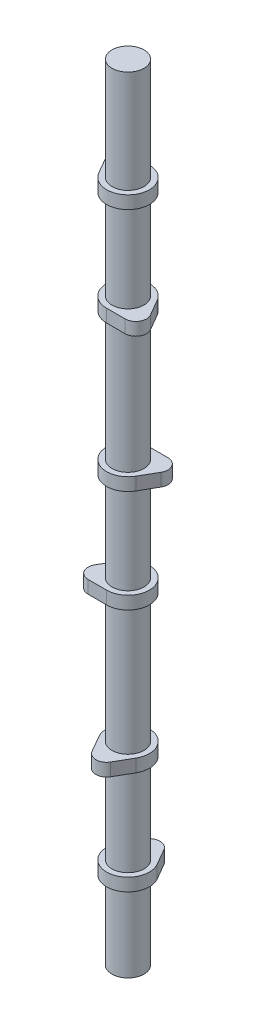
from build123d import *

# Parameters (mm, degrees)
BOSS_EXTRUDE1_DEPTH   = 7.62
LPATTERN1_COUNT       = 2
LPATTERN1_PITCH       = 60.96
BODY_MOVE_COPY1_ANGLE = 180
LPATTERN2_COUNT       = 3
LPATTERN2_PITCH       = 145.05
BODY_MOVE_COPY2_ANGLE = 120
BODY_MOVE_COPY3_ANGLE = 120
BOSS_EXTRUDE2_START   = -46.53
SKETCH2_R             = 9.5
BOSS_EXTRUDE2_DEPTH   = 466.09


with BuildPart() as part:
    # Sketch1 → Boss-Extrude1 (new body)
    with BuildSketch(Plane(origin=(0, 0, 0), x_dir=(1, 0, 0), z_dir=(0, 1, 0))):
        with BuildLine():
            Line((-5.499261314, 15.875), (-10.998522628, 6.35))
            ThreePointArc((-10.998522628, 6.35), (0, -12.7), (10.998522628, 6.35))
            Line((10.998522628, 6.35), (5.499261314, 15.875))
            ThreePointArc((5.499261314, 15.875), (0, 19.05), (-5.499261314, 15.875))
        make_face()
    extrude(amount=BOSS_EXTRUDE1_DEPTH)


with BuildPart() as lpattern1_1:
    # LPattern1: pattern copy
    add(part.part.moved(Location(Vector(0, 1, 0) * (1 * LPATTERN1_PITCH))))


with BuildPart() as lpattern1_1_1:
    # Body-Move/Copy1: moved
    add(lpattern1_1.part.rotate(Axis((0, 0, 0), (0, 1, 0)), BODY_MOVE_COPY1_ANGLE))


with BuildPart() as lpattern2_1:
    # LPattern2: pattern copy
    add(part.part.moved(Location(Vector(0, 1, 0) * (1 * LPATTERN2_PITCH))))


with BuildPart() as lpattern2_2:
    # LPattern2: pattern copy
    add(part.part.moved(Location(Vector(0, 1, 0) * (2 * LPATTERN2_PITCH))))


with BuildPart() as lpattern2_3:
    # LPattern2: pattern copy
    add(lpattern1_1_1.part.moved(Location(Vector(0, 1, 0) * (1 * LPATTERN2_PITCH))))


with BuildPart() as lpattern2_4:
    # LPattern2: pattern copy
    add(lpattern1_1_1.part.moved(Location(Vector(0, 1, 0) * (2 * LPATTERN2_PITCH))))


with BuildPart() as lpattern2_1_1:
    # Body-Move/Copy2: moved
    add(lpattern2_1.part.rotate(Axis((0, 0, 0), (0, 1, 0)), BODY_MOVE_COPY2_ANGLE))


with BuildPart() as lpattern2_3_1:
    # Body-Move/Copy2: moved
    add(lpattern2_3.part.rotate(Axis((0, 0, 0), (0, 1, 0)), BODY_MOVE_COPY2_ANGLE))


with BuildPart() as lpattern2_2_1:
    # Body-Move/Copy3: moved
    add(lpattern2_2.part.rotate(Axis((0, 0, 0), (0, -1, 0)), BODY_MOVE_COPY3_ANGLE))


with BuildPart() as lpattern2_4_1:
    # Body-Move/Copy3: moved
    add(lpattern2_4.part.rotate(Axis((0, 0, 0), (0, -1, 0)), BODY_MOVE_COPY3_ANGLE))


with BuildPart() as part_1:
    add(part.part)

    add(lpattern1_1_1.part)  # Boss-Extrude2 merges LPattern1_1

    add(lpattern2_1_1.part)  # Boss-Extrude2 merges LPattern2_1

    add(lpattern2_2_1.part)  # Boss-Extrude2 merges LPattern2_2

    add(lpattern2_3_1.part)  # Boss-Extrude2 merges LPattern2_3

    add(lpattern2_4_1.part)  # Boss-Extrude2 merges LPattern2_4
    # Sketch2 → Boss-Extrude2 (add)
    with BuildSketch(Plane(origin=(0, 0, 0), x_dir=(1, 0, 0), z_dir=(0, 1, 0)).offset(BOSS_EXTRUDE2_START)):
        Circle(SKETCH2_R)
    extrude(amount=BOSS_EXTRUDE2_DEPTH)


solid = part_1.part
